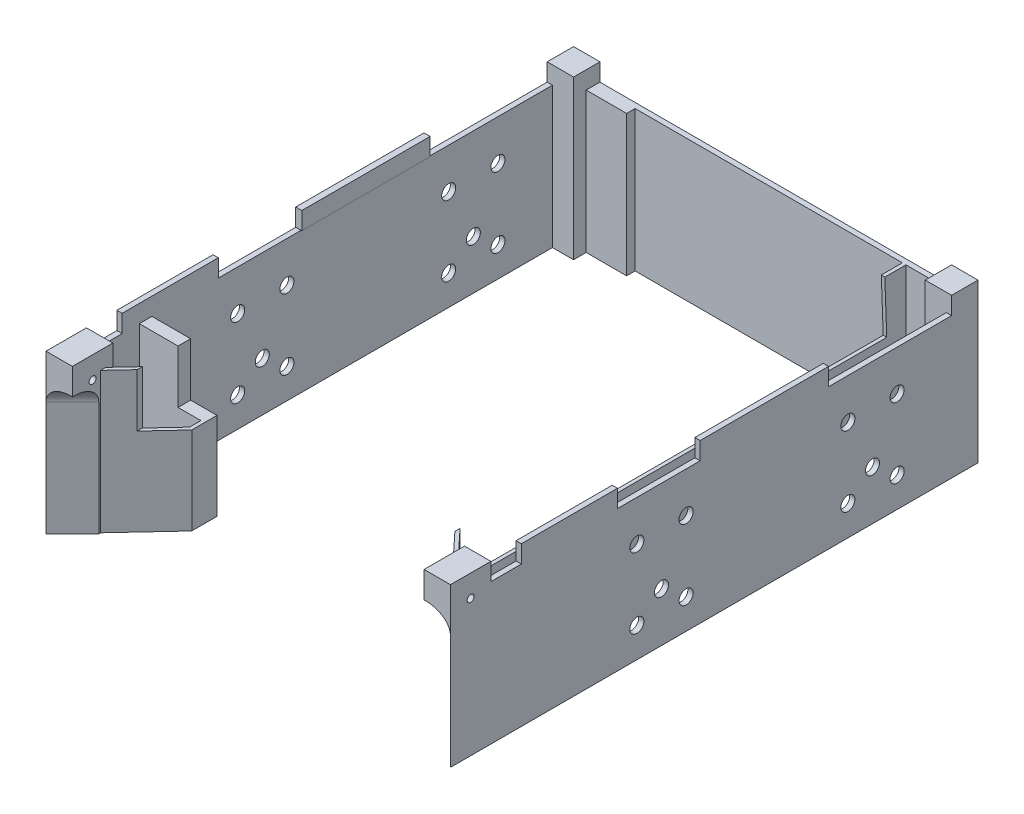
from build123d import *

# Parameters (mm, degrees)
BOSS_EXTRUDE1_DEPTH     = 80
CUT_EXTRUDE1_DEPTH      = 206.243757518
CUT_EXTRUDE1_DEPTH_BACK = 206.243757518
SKETCH2_R               = 4
SKETCH5_W               = 15
SKETCH5_H               = 15
BOSS_EXTRUDE2_DEPTH     = 90
CUT_EXTRUDE2_DEPTH      = 230
CUT_EXTRUDE2_DEPTH_BACK = 10
SKETCH6_R               = 4
CUT_EXTRUDE3_DEPTH      = 80
CUT_EXTRUDE3_DEPTH_BACK = 90
SKETCH8_W               = 15
SKETCH8_H               = 23
BOSS_EXTRUDE3_DEPTH     = 15
FILLET1_R               = 10
FILLET2_R               = 10
CUT_EXTRUDE5_DEPTH      = 245
CUT_EXTRUDE5_DEPTH_BACK = 278.173231031
SKETCH9_R               = 2
SKETCH11_W              = 3.463440771
SKETCH11_H              = 73
SKETCH11_W_2            = 3
SKETCH11_H_2            = 54.709634628
BOSS_EXTRUDE4_DEPTH     = 10


with BuildPart() as part:
    # Sketch1 → Boss-Extrude1 (new body)
    with BuildSketch(Plane(origin=(0, 0, 0), x_dir=(1, 0, 0), z_dir=(0, 1, 0))):
        Polygon((-115, 150), (115, 150), (115, -150), (75, -107.115172571), (75, 147), (-75, 147), (-77, 147), (-77, 142.176566344), (-112, 142.176566344), (-112, -92.757359313), (-75, -92.757359313), (-75, -107.115172571), (-115, -150), (-115, -147), (-115, -92.757359313), (-115, 147), align=None)
        Polygon((112, 147), (112, -112), (112, -143.851442339), (77, -106.327218338), (77, 147), align=None, mode=Mode.SUBTRACT)
        Polygon((-112, -112), (-112, -143.851442339), (-77, -106.327218338), (-77, -99.920571676), (-112, -99.920571676), align=None, mode=Mode.SUBTRACT)
    extrude(amount=BOSS_EXTRUDE1_DEPTH)

    # Sketch2 → Cut-Extrude1 (cut, two sides: drawn at the far end of the back side and taken through both)
    with BuildSketch(Plane(origin=(0, 0, 0), x_dir=(0, 0, -1), z_dir=(1, 0, 0)).offset(-CUT_EXTRUDE1_DEPTH_BACK)):
        with Locations((90, 28)):
            Circle(SKETCH2_R)
        with Locations((-30, 28)):
            Circle(SKETCH2_R)
    extrude(amount=CUT_EXTRUDE1_DEPTH + CUT_EXTRUDE1_DEPTH_BACK, mode=Mode.SUBTRACT)

    # Sketch5 → Boss-Extrude2 (add)
    with BuildSketch(Plane(origin=(0, 0, 0), x_dir=(1, 0, 0), z_dir=(0, 1, 0))):
        Polygon((-115, -127), (-100, -127), (-100, -135), (-115, -150), (-115, -140.427238406), align=None)
        Polygon((115, -150), (100, -135), (100, -127), (115, -127), (115, -140.427238406), align=None)
        with Locations((107.5, 142.5)):
            Rectangle(SKETCH5_W, SKETCH5_H)
        with Locations((-107.5, 142.5)):
            Rectangle(SKETCH5_W, SKETCH5_H)
    extrude(amount=BOSS_EXTRUDE2_DEPTH)

    # Sketch6 → Cut-Extrude2 (cut, two sides: drawn at the far end of the back side and taken through both)
    with BuildSketch(Plane(origin=(-112, 0, 0), x_dir=(0, 0, -1), z_dir=(1, 0, 0)).offset(-CUT_EXTRUDE2_DEPTH_BACK)):
        with Locations((76, 17)):
            Circle(SKETCH6_R)
        with Locations((104, 17)):
            Circle(SKETCH6_R)
        with Locations((104, 57)):
            Circle(SKETCH6_R)
        with Locations((76, 57)):
            Circle(SKETCH6_R)
        with Locations((-16, 57)):
            Circle(SKETCH6_R)
        with Locations((-44, 57)):
            Circle(SKETCH6_R)
        with Locations((-44, 17)):
            Circle(SKETCH6_R)
        with Locations((-16, 17)):
            Circle(SKETCH6_R)
    extrude(amount=CUT_EXTRUDE2_DEPTH + CUT_EXTRUDE2_DEPTH_BACK, mode=Mode.SUBTRACT)

    # Sketch7 → Cut-Extrude3 (cut, two sides: drawn at the far end of the back side and taken through both)
    with BuildSketch(Plane(origin=(0, 0, 0), x_dir=(0, 0, -1), z_dir=(1, 0, 0)).offset(-CUT_EXTRUDE3_DEPTH_BACK)):
        Polygon((-127, 80), (-127, 49.75530595), (136.100135801, 49.75530595), (135, 80), align=None)
    extrude(amount=CUT_EXTRUDE3_DEPTH + CUT_EXTRUDE3_DEPTH_BACK, mode=Mode.SUBTRACT)

    # Sketch8 → Boss-Extrude3 (add)
    with BuildSketch(Plane(origin=(0, 90, 0), x_dir=(1, 0, 0), z_dir=(0, 1, 0))):
        with Locations((107.5, -138.5)):
            Rectangle(SKETCH8_W, SKETCH8_H)
        with Locations((-107.5, -138.5)):
            Rectangle(SKETCH8_W, SKETCH8_H)
    extrude(amount=-BOSS_EXTRUDE3_DEPTH)

    # Fillet1
    fillet1_edges = [part.edges().sort_by_distance(p)[0] for p in [
        (107.5, 75, 142.5),
    ]]
    fillet(fillet1_edges, radius=FILLET1_R)

    # Fillet2
    fillet2_edges = [part.edges().sort_by_distance(p)[0] for p in [
        (-107.5, 75, 142.5),
    ]]
    fillet(fillet2_edges, radius=FILLET2_R)

    # Sketch9 → Cut-Extrude5 (cut, two sides: drawn at the far end of the back side and taken through both)
    with BuildSketch(Plane.ZY.offset(-100).offset(-CUT_EXTRUDE5_DEPTH_BACK)):
        with Locations(Location((138.5, 77.5, 0), (0, 0, 180))):
            Circle(SKETCH9_R)
    extrude(amount=CUT_EXTRUDE5_DEPTH + CUT_EXTRUDE5_DEPTH_BACK, mode=Mode.SUBTRACT)

    # Sketch11 → Boss-Extrude4 (add, through all)
    with BuildSketch(Plane(origin=(0, 80, 0), x_dir=(1, 0, 0), z_dir=(0, 1, 0))):
        with Locations((-113.268279615, 28.5)):
            Rectangle(SKETCH11_W, SKETCH11_H)
        with Locations((113.5, 28.5)):
            Rectangle(SKETCH11_W_2, SKETCH11_H)
        with Locations((-113.5, -82.354817314)):
            Rectangle(SKETCH11_W_2, SKETCH11_H_2)
        with Locations((113.5, -82.354817314)):
            Rectangle(SKETCH11_W_2, SKETCH11_H_2)
    extrude(amount=BOSS_EXTRUDE4_DEPTH)


solid = part.part
